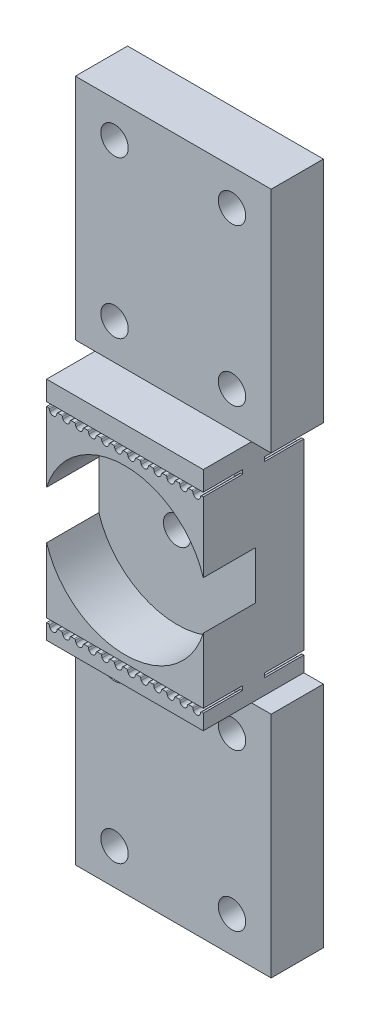
from build123d import *

# Parameters (mm, degrees)
BOSS_EXTRUDE1_DEPTH = 6
SKETCH2_W           = 15
SKETCH2_H           = 34.66
BOSS_EXTRUDE2_DEPTH = 1.7
SKETCH3_W           = 3
SKETCH3_H           = 34.66
CUT_EXTRUDE1_DEPTH  = 7.7
SKETCH4_R           = 12.55
CUT_EXTRUDE2_DEPTH  = 8
CUT_EXTRUDE3_REACH  = 37.195
SKETCH6_R           = 2.1
SKETCH7_R           = 2.1
BOSS_EXTRUDE3_DEPTH = 8


with BuildPart() as part:
    # Sketch1 → Boss-Extrude1 (new body)
    with BuildSketch(Plane.XY):
        with BuildLine():
            Line((-0.259824575, -0.254), (0, -0.254))
            Line((0, -0.254), (0.259824575, -0.254))
            ThreePointArc((0.259824575, -0.254), (0.358731646, -0.291228588), (0.408543109, -0.384434783))
            ThreePointArc((0.408543109, -0.384434783), (0.442388286, -0.542062154), (0.501123596, -0.692202247))
            ThreePointArc((0.501123596, -0.692202247), (1, -1.004), (1.498876404, -0.692202247))
            ThreePointArc((1.498876404, -0.692202247), (1.557611714, -0.542062154), (1.591456891, -0.384434783))
            ThreePointArc((1.591456891, -0.384434783), (1.641268354, -0.291228588), (1.740175425, -0.254))
            Line((1.740175425, -0.254), (2, -0.25399999))
            Line((2, -0.25399999), (2.259824575, -0.25399999))
            ThreePointArc((2.259824575, -0.25399999), (2.358731646, -0.291228578), (2.408543109, -0.384434773))
            ThreePointArc((2.408543109, -0.384434773), (2.442388286, -0.542062144), (2.501123596, -0.692202237))
            ThreePointArc((2.501123596, -0.692202237), (3, -1.00399999), (3.498876404, -0.692202237))
            ThreePointArc((3.498876404, -0.692202237), (3.557611714, -0.542062144), (3.591456891, -0.384434773))
            ThreePointArc((3.591456891, -0.384434773), (3.641268354, -0.291228578), (3.740175425, -0.25399999))
            Line((3.740175425, -0.25399999), (4, -0.25399998))
            Line((4, -0.25399998), (4.259824575, -0.25399998))
            ThreePointArc((4.259824575, -0.25399998), (4.358731646, -0.291228568), (4.408543109, -0.384434763))
            ThreePointArc((4.408543109, -0.384434763), (4.442388286, -0.542062134), (4.501123596, -0.692202227))
            ThreePointArc((4.501123596, -0.692202227), (5, -1.00399998), (5.498876404, -0.692202227))
            ThreePointArc((5.498876404, -0.692202227), (5.557611714, -0.542062134), (5.591456891, -0.384434763))
            ThreePointArc((5.591456891, -0.384434763), (5.641268354, -0.291228568), (5.740175425, -0.25399998))
            Line((5.740175425, -0.25399998), (6, -0.25399997))
            Line((6, -0.25399997), (6.259824575, -0.25399997))
            ThreePointArc((6.259824575, -0.25399997), (6.358731646, -0.291228558), (6.408543109, -0.384434752))
            ThreePointArc((6.408543109, -0.384434752), (6.442388286, -0.542062124), (6.501123596, -0.692202217))
            ThreePointArc((6.501123596, -0.692202217), (7, -1.00399997), (7.498876404, -0.692202217))
            ThreePointArc((7.498876404, -0.692202217), (7.557611714, -0.542062124), (7.591456891, -0.384434752))
            ThreePointArc((7.591456891, -0.384434752), (7.641268354, -0.291228558), (7.740175425, -0.25399997))
            Line((7.740175425, -0.25399997), (8, -0.25399996))
            Line((8, -0.25399996), (8.259824575, -0.25399996))
            ThreePointArc((8.259824575, -0.25399996), (8.358731646, -0.291228548), (8.408543109, -0.384434742))
            ThreePointArc((8.408543109, -0.384434742), (8.442388286, -0.542062114), (8.501123596, -0.692202207))
            ThreePointArc((8.501123596, -0.692202207), (9, -1.00399996), (9.498876404, -0.692202207))
            ThreePointArc((9.498876404, -0.692202207), (9.557611714, -0.542062114), (9.591456891, -0.384434742))
            ThreePointArc((9.591456891, -0.384434742), (9.641268354, -0.291228548), (9.740175425, -0.25399996))
            Line((9.740175425, -0.25399996), (10, -0.25399995))
            Line((10, -0.25399995), (10, -3.253994292))
            Line((10, -3.253994292), (10, -28.304))
            Line((10, -28.304), (-2, -28.304))
            Line((-2, -28.304), (-2, -28.93399999))
            Line((-2, -28.93399999), (-1.740175425, -28.934))
            ThreePointArc((-1.740175425, -28.934), (-1.641268354, -28.971228588), (-1.591456891, -29.064434783))
            ThreePointArc((-1.591456891, -29.064434783), (-1.557611714, -29.222062154), (-1.498876404, -29.372202247))
            ThreePointArc((-1.498876404, -29.372202247), (-1, -29.684), (-0.501123596, -29.372202247))
            ThreePointArc((-0.501123596, -29.372202247), (-0.442388286, -29.222062154), (-0.408543109, -29.064434783))
            ThreePointArc((-0.408543109, -29.064434783), (-0.358731646, -28.971228588), (-0.259824575, -28.934))
            Line((-0.259824575, -28.934), (0, -28.934))
            Line((0, -28.934), (0.259824575, -28.934))
            ThreePointArc((0.259824575, -28.934), (0.358731646, -28.971228588), (0.408543109, -29.064434783))
            ThreePointArc((0.408543109, -29.064434783), (0.442388286, -29.222062154), (0.501123596, -29.372202247))
            ThreePointArc((0.501123596, -29.372202247), (1, -29.684), (1.498876404, -29.372202247))
            ThreePointArc((1.498876404, -29.372202247), (1.557611714, -29.222062154), (1.591456891, -29.064434783))
            ThreePointArc((1.591456891, -29.064434783), (1.641268354, -28.971228588), (1.740175425, -28.934))
            Line((1.740175425, -28.934), (2, -28.93399999))
            Line((2, -28.93399999), (2.259824575, -28.93399999))
            ThreePointArc((2.259824575, -28.93399999), (2.358731646, -28.971228578), (2.408543109, -29.064434773))
            ThreePointArc((2.408543109, -29.064434773), (2.442388286, -29.222062144), (2.501123596, -29.372202237))
            ThreePointArc((2.501123596, -29.372202237), (3, -29.68399999), (3.498876404, -29.372202237))
            ThreePointArc((3.498876404, -29.372202237), (3.557611714, -29.222062144), (3.591456891, -29.064434773))
            ThreePointArc((3.591456891, -29.064434773), (3.641268354, -28.971228578), (3.740175425, -28.93399999))
            Line((3.740175425, -28.93399999), (4, -28.93399998))
            Line((4, -28.93399998), (4.259824575, -28.93399998))
            ThreePointArc((4.259824575, -28.93399998), (4.358731646, -28.971228568), (4.408543109, -29.064434763))
            ThreePointArc((4.408543109, -29.064434763), (4.442388286, -29.222062134), (4.501123596, -29.372202227))
            ThreePointArc((4.501123596, -29.372202227), (5, -29.68399998), (5.498876404, -29.372202227))
            ThreePointArc((5.498876404, -29.372202227), (5.557611714, -29.222062134), (5.591456891, -29.064434763))
            ThreePointArc((5.591456891, -29.064434763), (5.641268354, -28.971228568), (5.740175425, -28.93399998))
            Line((5.740175425, -28.93399998), (6, -28.93399997))
            Line((6, -28.93399997), (6.259824575, -28.93399997))
            ThreePointArc((6.259824575, -28.93399997), (6.358731646, -28.971228558), (6.408543109, -29.064434752))
            ThreePointArc((6.408543109, -29.064434752), (6.442388286, -29.222062124), (6.501123596, -29.372202217))
            ThreePointArc((6.501123596, -29.372202217), (7, -29.68399997), (7.498876404, -29.372202217))
            ThreePointArc((7.498876404, -29.372202217), (7.557611714, -29.222062124), (7.591456891, -29.064434752))
            ThreePointArc((7.591456891, -29.064434752), (7.641268354, -28.971228558), (7.740175425, -28.93399997))
            Line((7.740175425, -28.93399997), (8, -28.93399996))
            Line((8, -28.93399996), (8.259824575, -28.93399996))
            ThreePointArc((8.259824575, -28.93399996), (8.358731646, -28.971228548), (8.408543109, -29.064434742))
            ThreePointArc((8.408543109, -29.064434742), (8.442388286, -29.222062114), (8.501123596, -29.372202207))
            ThreePointArc((8.501123596, -29.372202207), (9, -29.68399996), (9.498876404, -29.372202207))
            ThreePointArc((9.498876404, -29.372202207), (9.557611714, -29.222062114), (9.591456891, -29.064434742))
            ThreePointArc((9.591456891, -29.064434742), (9.641268354, -28.971228548), (9.740175425, -28.93399996))
            Line((9.740175425, -28.93399996), (10, -28.93399995))
            Line((10, -28.93399995), (10, -31.284))
            Line((10, -31.284), (-5, -31.284))
            Line((-5, -31.284), (-5, -3.253998618))
            Line((-5, -3.253998618), (-5, 3.376))
            Line((-5, 3.376), (-2, 3.376))
            Line((-2, 3.376), (10, 3.376))
            Line((10, 3.376), (10, 0.376))
            Line((10, 0.376), (-2, 0.376))
            Line((-2, 0.376), (-2, -0.25399999))
            Line((-2, -0.25399999), (-1.740175425, -0.254))
            ThreePointArc((-1.740175425, -0.254), (-1.641268354, -0.291228588), (-1.591456891, -0.384434783))
            ThreePointArc((-1.591456891, -0.384434783), (-1.557611714, -0.542062154), (-1.498876404, -0.692202247))
            ThreePointArc((-1.498876404, -0.692202247), (-1, -1.004), (-0.501123596, -0.692202247))
            ThreePointArc((-0.501123596, -0.692202247), (-0.442388286, -0.542062154), (-0.408543109, -0.384434783))
            ThreePointArc((-0.408543109, -0.384434783), (-0.358731646, -0.291228588), (-0.259824575, -0.254))
        make_face()
    extrude(amount=BOSS_EXTRUDE1_DEPTH)

    # Sketch2 → Boss-Extrude2 (add)
    with BuildSketch(Plane(origin=(0, 0, 0), x_dir=(-1, 0, 0), z_dir=(0, 0, -1))):
        with Locations((-2.5, -13.954)):
            Rectangle(SKETCH2_W, SKETCH2_H)
    extrude(amount=BOSS_EXTRUDE2_DEPTH)

    # Sketch3 → Cut-Extrude1 (cut)
    with BuildSketch(Plane.XY.offset(6)):
        with Locations((-3.5, -13.954)):
            Rectangle(SKETCH3_W, SKETCH3_H)
    extrude(amount=-CUT_EXTRUDE1_DEPTH, mode=Mode.SUBTRACT)

    # Mirror1: part across plane


with BuildPart() as part_1:
    add(part.part)
    add(part.part.mirror(Plane(origin=(-2, 3.376, -36.489590397), x_dir=(0, 0, 1), z_dir=(1, 0, 0))))

    # Mirror2: part across plane


with BuildPart() as part_2:
    add(part_1.part)
    add(part_1.part.mirror(Plane(origin=(0, 0, -1.7), x_dir=(1, 0, 0), z_dir=(0, 0, -1))))

    # Sketch4 → Cut-Extrude2 (cut)
    with BuildSketch(Plane.XY.offset(6)):
        with Locations((-2, -14.653999985)):
            Circle(SKETCH4_R)
    extrude(amount=-CUT_EXTRUDE2_DEPTH, mode=Mode.SUBTRACT)

    # Sketch6 → Cut-Extrude3 (cut, up to next)
    with BuildSketch(Plane.XY.offset(-2), mode=Mode.PRIVATE) as cut_extrude3_sk1:
        with Locations((-2, -14.653999985)):
            Circle(SKETCH6_R)
    cut_extrude3_tool1 = extrude(cut_extrude3_sk1.sketch, amount=-CUT_EXTRUDE3_REACH, mode=Mode.PRIVATE) & part_2.part
    add(cut_extrude3_tool1.solids().sort_by_distance((-2, -14.654, -2))[0], mode=Mode.SUBTRACT)

    # Sketch7 → Boss-Extrude3 (add)
    # profile 1 of 2: a face of its own
    with BuildSketch(Plane(origin=(0, 0, -9.4), x_dir=(-1, 0, 0), z_dir=(0, 0, -1))):
        Polygon((14, 3.376), (17, 3.376), (17, 38.376), (-13, 38.376), (-13, 3.376), (-10, 3.376), align=None)
        with Locations((11, 32.876)):
            Circle(SKETCH7_R, mode=Mode.SUBTRACT)
        with Locations(Location((11, 8.876, 0), (0, 0, 180))):
            Circle(SKETCH7_R, mode=Mode.SUBTRACT)
        with Locations((-7, 8.876)):
            Circle(SKETCH7_R, mode=Mode.SUBTRACT)
        with Locations(Location((-7, 32.876, 0), (0, 0, 180))):
            Circle(SKETCH7_R, mode=Mode.SUBTRACT)
    # profile 2 of 2: a face of its own
    with BuildSketch(Plane(origin=(0, 0, -9.4), x_dir=(-1, 0, 0), z_dir=(0, 0, -1))):
        Polygon((-10, -31.284), (14, -31.284), (17, -31.284), (17, -66.284), (-13, -66.284), (-13, -31.284), align=None)
        with Locations((-7, -60.784)):
            Circle(SKETCH7_R, mode=Mode.SUBTRACT)
        with Locations(Location((-7, -36.784, 0), (0, 0, 180))):
            Circle(SKETCH7_R, mode=Mode.SUBTRACT)
        with Locations((11, -36.784)):
            Circle(SKETCH7_R, mode=Mode.SUBTRACT)
        with Locations(Location((11, -60.784, 0), (0, 0, 180))):
            Circle(SKETCH7_R, mode=Mode.SUBTRACT)
    extrude(amount=-BOSS_EXTRUDE3_DEPTH)


solid = part_2.part
